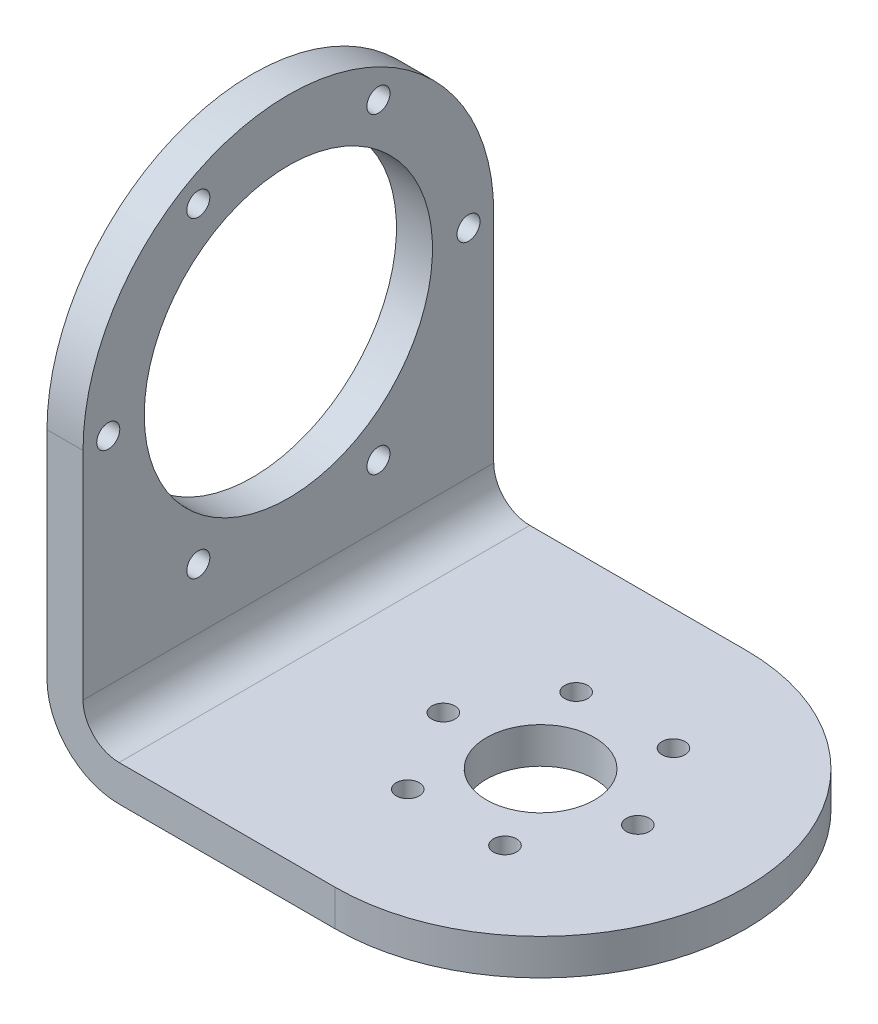
from build123d import *

# Parameters (mm, degrees)
SKETCH_1_R          = 28.5
SKETCH_1_W          = 5
SKETCH_1_H          = 57
EXTRUDE_1_DEPTH     = 5
SKETCH_2_R          = 1.6
SKETCH_2_R_2        = 20
EXTRUDE_2_DEPTH     = 5
FILLET_1_R          = 10
FILLET_2_R          = 5
SKETCH_3_R          = 1.6
SKETCH_3_R_2        = 7.5
CUT_EXTRUDE_1_DEPTH = 5


with BuildPart() as part:
    # 草图1 → 凸台-拉伸1 (new body)
    with BuildSketch(Plane(origin=(0, 0, 0), x_dir=(1, 0, 0), z_dir=(0, 1, 0))):
        with BuildLine():
            ThreePointArc((0, -28.5), (-28.5, 0), (0, 28.5))
            Line((0, 28.5), (-35, 28.5))
            Line((-35, 28.5), (-35, -28.5))
            Line((-35, -28.5), (0, -28.5))
        make_face()
        Circle(SKETCH_1_R)
        with Locations((-37.5, 0)):
            Rectangle(SKETCH_1_W, SKETCH_1_H)
    extrude(amount=EXTRUDE_1_DEPTH)

    # 草图2 → 凸台-拉伸2 (add)
    with BuildSketch(Plane.ZY.offset(40)):
        with BuildLine():
            Line((28.5, 0), (28.5, 40))
            ThreePointArc((28.5, 40), (0, 68.5), (-28.5, 40))
            Line((-28.5, 40), (-28.5, 0))
            Line((-28.5, 0), (28.5, 0))
        make_face()
        with Locations((12.5, 61.650635095)):
            Circle(SKETCH_2_R, mode=Mode.SUBTRACT)
        with Locations((-12.5, 18.349364905)):
            Circle(SKETCH_2_R, mode=Mode.SUBTRACT)
        with Locations((12.5, 18.349364905)):
            Circle(SKETCH_2_R, mode=Mode.SUBTRACT)
        with Locations((-25, 40)):
            Circle(SKETCH_2_R, mode=Mode.SUBTRACT)
        with Locations((-12.5, 61.650635095)):
            Circle(SKETCH_2_R, mode=Mode.SUBTRACT)
        with Locations((0, 40)):
            Circle(SKETCH_2_R_2, mode=Mode.SUBTRACT)
        with Locations((25, 40)):
            Circle(SKETCH_2_R, mode=Mode.SUBTRACT)
    extrude(amount=-EXTRUDE_2_DEPTH)

    # 圆角1
    fillet_1_edges = [part.edges().sort_by_distance(p)[0] for p in [
        (-40, 0, 0),
    ]]
    fillet(fillet_1_edges, radius=FILLET_1_R)

    # 圆角2
    fillet_2_edges = [part.edges().sort_by_distance(p)[0] for p in [
        (-35, 5, 0),
    ]]
    fillet(fillet_2_edges, radius=FILLET_2_R)

    # 草图3 → 切除-拉伸1 (cut)
    with BuildSketch(Plane(origin=(0, 5, 0), x_dir=(1, 0, 0), z_dir=(0, 1, 0))):
        with Locations(Location((13.5, 0, 0), (0, 0, 270))):
            Circle(SKETCH_3_R)
        with Locations(Location((6.75, -11.691342951, 0), (0, 0, 270))):
            Circle(SKETCH_3_R)
        with Locations(Location((-6.75, -11.691342951, 0), (0, 0, 270))):
            Circle(SKETCH_3_R)
        with Locations(Location((-13.5, 0, 0), (0, 0, 270))):
            Circle(SKETCH_3_R)
        with Locations(Location((-6.75, 11.691342951, 0), (0, 0, 270))):
            Circle(SKETCH_3_R)
        with Locations(Location((6.75, 11.691342951, 0), (0, 0, 270))):
            Circle(SKETCH_3_R)
        with Locations(Location((0, 0, 0), (0, 0, 270))):
            Circle(SKETCH_3_R_2)
    extrude(amount=-CUT_EXTRUDE_1_DEPTH, mode=Mode.SUBTRACT)


solid = part.part
